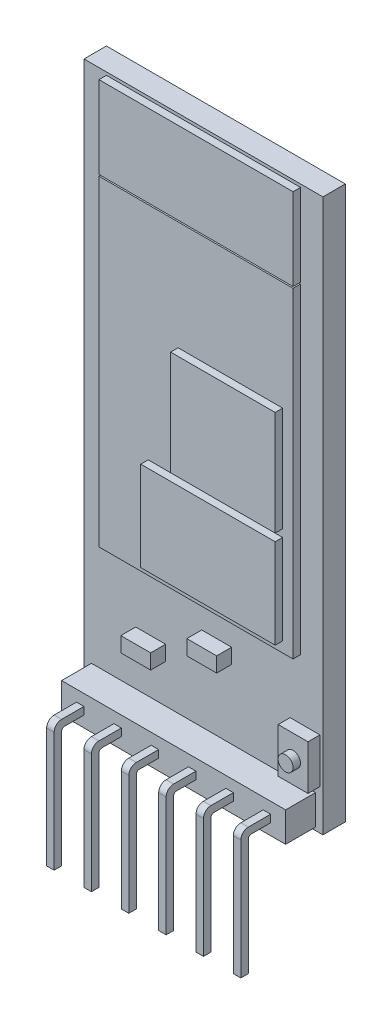
from build123d import *

# Parameters (mm, degrees)
SKETCH_1_W                     = 16
SKETCH_1_H                     = 37
EXTRUDE_1_DEPTH                = 1.5
SKETCH_2_W                     = 15
SKETCH_2_H                     = 2
EXTRUDE_2_DEPTH                = 2
SKETCH_3_W                     = 0.5
SKETCH_3_H                     = 0.5
EXTRUDE_3_DEPTH                = 2
SKETCH_4_W                     = 0.5
SKETCH_4_H                     = 0.5
EXTRUDE_4_DEPTH                = 8
FILLET_2_R                     = 0.5
FILLET_3_R                     = 0.2
PATTERN_LINEAR_1_COUNT         = 6
PATTERN_LINEAR_1_PITCH         = 2.5
FILLET_2_OF_PATTERN_LINEAR_1_R = 0.5
FILLET_3_OF_PATTERN_LINEAR_1_R = 0.2
SKETCH_7_W                     = 13
SKETCH_7_H                     = 5.5
EXTRUDE_7_DEPTH                = 0.5
SKETCH_8_W                     = 13
SKETCH_8_H                     = 21.5
EXTRUDE_8_DEPTH                = 0.5
SKETCH_9_W                     = 2
SKETCH_9_H                     = 3
EXTRUDE_9_DEPTH                = 0.8
SKETCH_10_R                    = 0.5
EXTRUDE_10_DEPTH               = 0.5
SKETCH_11_W                    = 2
SKETCH_11_H                    = 1
EXTRUDE_11_DEPTH               = 1
SKETCH_12_W                    = 7
SKETCH_12_H                    = 7
SKETCH_12_W_2                  = 9
SKETCH_12_H_2                  = 6
EXTRUDE_12_DEPTH               = 0.5


with BuildPart() as part:
    # 草图1 → 凸台-拉伸1 (new body)
    with BuildSketch(Plane.XY):
        with Locations((8, 18.5)):
            Rectangle(SKETCH_1_W, SKETCH_1_H)
    extrude(amount=EXTRUDE_1_DEPTH)

    # 草图2 → 凸台-拉伸2 (add)
    with BuildSketch(Plane.XY.offset(1.5)):
        with Locations((8, 1.2)):
            Rectangle(SKETCH_2_W, SKETCH_2_H)
    extrude(amount=EXTRUDE_2_DEPTH)

    # 草图3 → 凸台-拉伸3 (add)
    with BuildSketch(Plane.XY.offset(3.5)):
        with Locations((1.75, 1.2)):
            Rectangle(SKETCH_3_W, SKETCH_3_H)
    extrude_3 = extrude(amount=EXTRUDE_3_DEPTH)

    # 草图4 → 凸台-拉伸4 (add)
    with BuildSketch(Plane.XZ.offset(-0.95)):
        with Locations((1.75, 5.25)):
            Rectangle(SKETCH_4_W, SKETCH_4_H)
    extrude_4 = extrude(amount=EXTRUDE_4_DEPTH)

    # 圆角2
    fillet_2_edges = [part.edges().sort_by_distance(p)[0] for p in [
        (1.75, 1.45, 5.5),
    ]]
    fillet(fillet_2_edges, radius=FILLET_2_R)

    # 圆角3
    fillet_3_edges = [part.edges().sort_by_distance(p)[0] for p in [
        (1.75, 0.95, 5),
    ]]
    fillet(fillet_3_edges, radius=FILLET_3_R)

    # 阵列(线性)1: 凸台-拉伸3, 凸台-拉伸4 ×6
    with Locations(*[(i * PATTERN_LINEAR_1_PITCH, 0, 0) for i in range(1, PATTERN_LINEAR_1_COUNT)]):
        add(extrude_3)
        add(extrude_4)

    # 圆角2 of 阵列(线性)1
    fillet_2_of_pattern_linear_1_edges = [part.edges().sort_by_distance(p)[0] for p in [
        (4.25, 1.45, 5.5),
        (6.75, 1.45, 5.5),
        (9.25, 1.45, 5.5),
        (11.75, 1.45, 5.5),
        (14.25, 1.45, 5.5),
    ]]
    fillet(fillet_2_of_pattern_linear_1_edges, radius=FILLET_2_OF_PATTERN_LINEAR_1_R)

    # 圆角3 of 阵列(线性)1
    fillet_3_of_pattern_linear_1_edges = [part.edges().sort_by_distance(p)[0] for p in [
        (4.25, 0.95, 5),
        (6.75, 0.95, 5),
        (9.25, 0.95, 5),
        (11.75, 0.95, 5),
        (14.25, 0.95, 5),
    ]]
    fillet(fillet_3_of_pattern_linear_1_edges, radius=FILLET_3_OF_PATTERN_LINEAR_1_R)

    # 草图7 → 凸台-拉伸7 (add)
    with BuildSketch(Plane.XY.offset(1.5)):
        with Locations((8, 34.05)):
            Rectangle(SKETCH_7_W, SKETCH_7_H)
    extrude(amount=EXTRUDE_7_DEPTH)

    # 草图8 → 凸台-拉伸8 (add)
    with BuildSketch(Plane.XY.offset(1.5)):
        with Locations((8, 20.45)):
            Rectangle(SKETCH_8_W, SKETCH_8_H)
    extrude(amount=EXTRUDE_8_DEPTH)

    # 草图9 → 凸台-拉伸9 (add)
    with BuildSketch(Plane.XY.offset(1.5)):
        with Locations((14.8, 4.2)):
            Rectangle(SKETCH_9_W, SKETCH_9_H)
    extrude(amount=EXTRUDE_9_DEPTH)

    # 草图10 → 凸台-拉伸10 (add)
    with BuildSketch(Plane.XY.offset(2.3)):
        with Locations((14.8, 4.2)):
            Circle(SKETCH_10_R)
    extrude(amount=EXTRUDE_10_DEPTH)

    # 草图11 → 凸台-拉伸11 (add)
    with BuildSketch(Plane.XY.offset(1.5)):
        with Locations((8.882624218, 7.325014272)):
            Rectangle(SKETCH_11_W, SKETCH_11_H)
        with Locations((4.464220441, 5.288706444)):
            Rectangle(SKETCH_11_W, SKETCH_11_H)
    extrude(amount=EXTRUDE_11_DEPTH)

    # 草图12 → 凸台-拉伸12 (add)
    with BuildSketch(Plane.XY.offset(2)):
        with Locations((10.3, 20.4)):
            Rectangle(SKETCH_12_W, SKETCH_12_H)
        with Locations((9.3, 13.4)):
            Rectangle(SKETCH_12_W_2, SKETCH_12_H_2)
    extrude(amount=EXTRUDE_12_DEPTH)


solid = part.part
